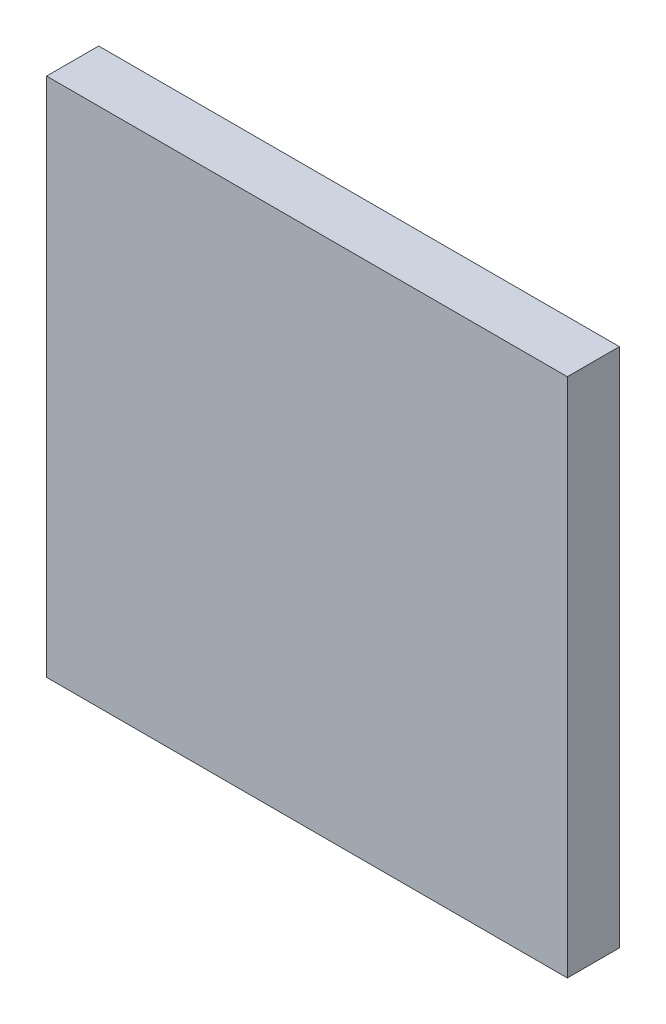
from build123d import *

# Parameters (mm, degrees)
ESQUISSE1_W      = 10
ESQUISSE1_H      = 10
EXTRUSION1_DEPTH = 1


with BuildPart() as part:
    # Esquisse1 → Extrusion1 (new body)
    with BuildSketch(Plane.XY):
        Rectangle(ESQUISSE1_W, ESQUISSE1_H)
    extrude(amount=EXTRUSION1_DEPTH)


solid = part.part
